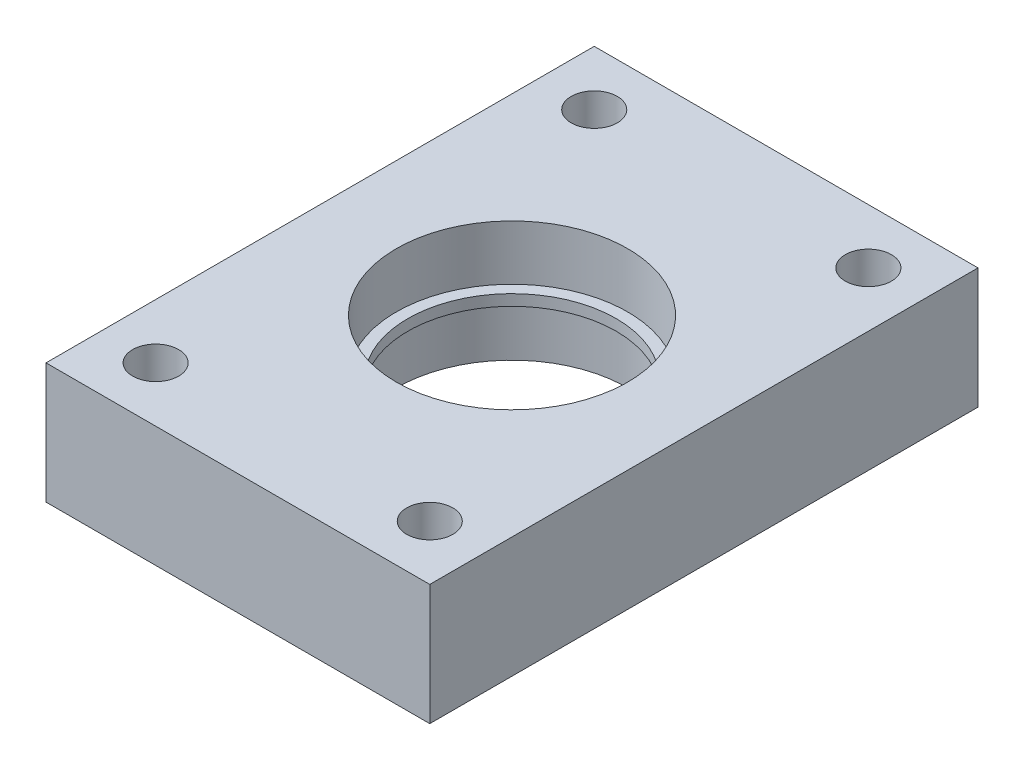
from build123d import *

# Parameters (mm, degrees)
SKETCH_1_R          = 9.5
EXTRUDE_1_DEPTH     = 11
SKETCH_2_R          = 10.55
CUT_EXTRUDE_1_DEPTH = 5
SKETCH_3_W          = 35
SKETCH_3_H          = 4
EXTRUDE_2_DEPTH     = 31
SKETCH_5_R          = 10.5
SKETCH_5_R_2        = 2.1
EXTRUDE_3_DEPTH     = 3.5
SKETCH_7_W          = 61.53340186
SKETCH_7_H          = 39.361856863
CUT_EXTRUDE_4_DEPTH = 56.138462075
SKETCH_8_R          = 2.1
CUT_EXTRUDE_5_DEPTH = 20
SKETCH_9_R          = 3.8
CUT_EXTRUDE_6_DEPTH = 2.2


with BuildPart() as part:
    # 草图1 → 凸台-拉伸1 (new body)
    with BuildSketch(Plane(origin=(0, 0, 0), x_dir=(1, 0, 0), z_dir=(0, 1, 0))):
        Polygon((-17.5, 0), (-17.5, -25), (17.5, -25), (17.5, 0), (17.5, 25), (-17.5, 25), align=None)
        with Locations(Location((0, 0, 0), (0, 0, 270))):
            Circle(SKETCH_1_R, mode=Mode.SUBTRACT)
    extrude(amount=EXTRUDE_1_DEPTH)

    # 草图2 → 切除-拉伸1 (cut)
    with BuildSketch(Plane(origin=(0, 11, 0), x_dir=(1, 0, 0), z_dir=(0, 1, 0))):
        with Locations(Location((0, 0, 0), (0, 0, 270))):
            Circle(SKETCH_2_R)
    cut_extrude_1 = extrude(amount=-CUT_EXTRUDE_1_DEPTH, mode=Mode.SUBTRACT)

    # 镜向1: 切除-拉伸1 across plane
    add(cut_extrude_1.mirror(Plane.ZX.offset(5.5)), mode=Mode.SUBTRACT)

    # 草图3 → 凸台-拉伸2 (add)
    with BuildSketch(Plane.XZ):
        with Locations((0, 23)):
            Rectangle(SKETCH_3_W, SKETCH_3_H)
    extrude(amount=EXTRUDE_2_DEPTH)

    # 草图5 → 凸台-拉伸3 (add)
    with BuildSketch(Plane.XZ.offset(31)):
        with BuildLine():
            Line((-17.5, 25), (-17.5, 0))
            ThreePointArc((-17.5, 0), (0, -17.5), (17.5, 0))
            Line((17.5, 0), (17.5, 25))
            Line((17.5, 25), (-17.5, 25))
        make_face()
        with Locations(Location((0, 0, 0), (0, 0, 270))):
            Circle(SKETCH_5_R, mode=Mode.SUBTRACT)
        with Locations(Location((0, 14, 0), (0, 0, 270))):
            Circle(SKETCH_5_R_2, mode=Mode.SUBTRACT)
        with Locations(Location((14, 0, 0), (0, 0, 270))):
            Circle(SKETCH_5_R_2, mode=Mode.SUBTRACT)
        with Locations(Location((0, -14, 0), (0, 0, 270))):
            Circle(SKETCH_5_R_2, mode=Mode.SUBTRACT)
        with Locations(Location((-14, 0, 0), (0, 0, 270))):
            Circle(SKETCH_5_R_2, mode=Mode.SUBTRACT)
    extrude(amount=EXTRUDE_3_DEPTH)

    # 草图7 → 切除-拉伸4 (cut, through all)
    with BuildSketch(Plane.ZY.offset(17.5)):
        with Locations((-3.514973955, -19.680928431)):
            Rectangle(SKETCH_7_W, SKETCH_7_H)
    extrude(amount=-CUT_EXTRUDE_4_DEPTH, mode=Mode.SUBTRACT)

    # 草图8 → 切除-拉伸5 (cut)
    with BuildSketch(Plane.XZ):
        with Locations(Location((-12.5, 20, 0), (0, 0, 270))):
            Circle(SKETCH_8_R)
        with Locations(Location((12.5, 20, 0), (0, 0, 90))):
            Circle(SKETCH_8_R)
        with Locations(Location((12.5, -20, 0), (0, 0, 270))):
            Circle(SKETCH_8_R)
        with Locations(Location((-12.5, -20, 0), (0, 0, 90))):
            Circle(SKETCH_8_R)
    extrude(amount=-CUT_EXTRUDE_5_DEPTH, mode=Mode.SUBTRACT)

    # 草图9 → 切除-拉伸6 (cut)
    with BuildSketch(Plane.XZ):
        with Locations(Location((-12.5, 20, 0), (0, 0, 270))):
            Circle(SKETCH_9_R)
        with Locations(Location((12.5, 20, 0), (0, 0, 90))):
            Circle(SKETCH_9_R)
        with Locations(Location((12.5, -20, 0), (0, 0, 270))):
            Circle(SKETCH_9_R)
        with Locations(Location((-12.5, -20, 0), (0, 0, 90))):
            Circle(SKETCH_9_R)
    extrude(amount=-CUT_EXTRUDE_6_DEPTH, mode=Mode.SUBTRACT)


solid = part.part
